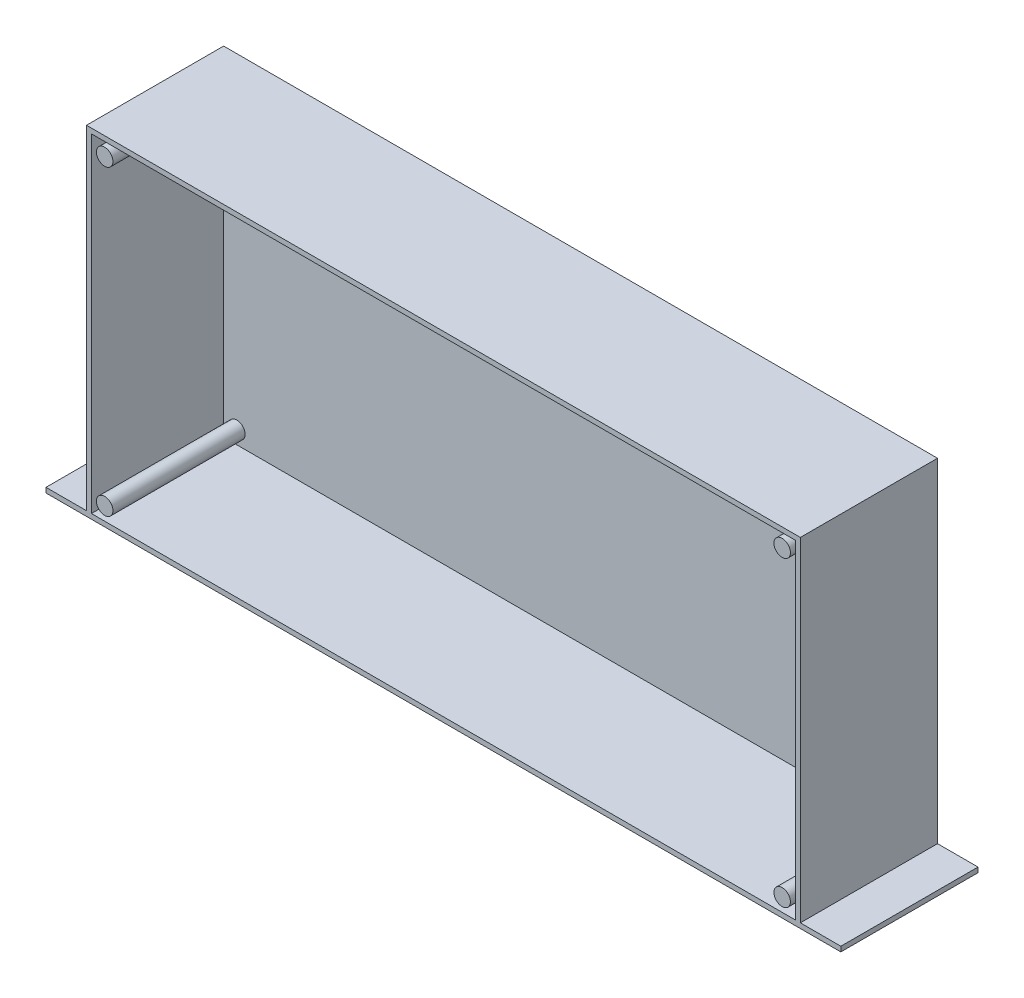
from build123d import *

# Parameters (mm, degrees)
BOSS_EXTRUDE1_DEPTH = 3
SKETCH2_W           = 426
SKETCH2_H           = 199
BOSS_EXTRUDE2_DEPTH = 80
SKETCH3_R           = 5
BOSS_EXTRUDE3_DEPTH = 80


with BuildPart() as part:
    # Sketch1 → Boss-Extrude1 (new body)
    with BuildSketch(Plane.XY):
        Polygon((0, 0), (-24.5, 0), (-24.5, 3), (0, 3), (0, 205), (432, 205), (432, 3), (456.5, 3), (456.5, 0), (432, 0), align=None)
    extrude(amount=BOSS_EXTRUDE1_DEPTH)

    # Sketch2 → Boss-Extrude2 (add)
    with BuildSketch(Plane.XY.offset(3)):
        Polygon((432, 205), (0, 205), (0, 3), (-24.5, 3), (-24.5, 0), (456.5, 0), (456.5, 3), (432, 3), align=None)
        with Locations((216, 102.5)):
            Rectangle(SKETCH2_W, SKETCH2_H, mode=Mode.SUBTRACT)
    extrude(amount=BOSS_EXTRUDE2_DEPTH)

    # Sketch3 → Boss-Extrude3 (add)
    with BuildSketch(Plane.XY.offset(3)):
        with Locations((11, 194)):
            Circle(SKETCH3_R)
        with Locations((421, 194)):
            Circle(SKETCH3_R)
        with Locations((421, 11)):
            Circle(SKETCH3_R)
        with Locations((11, 11)):
            Circle(SKETCH3_R)
    extrude(amount=BOSS_EXTRUDE3_DEPTH)


solid = part.part
